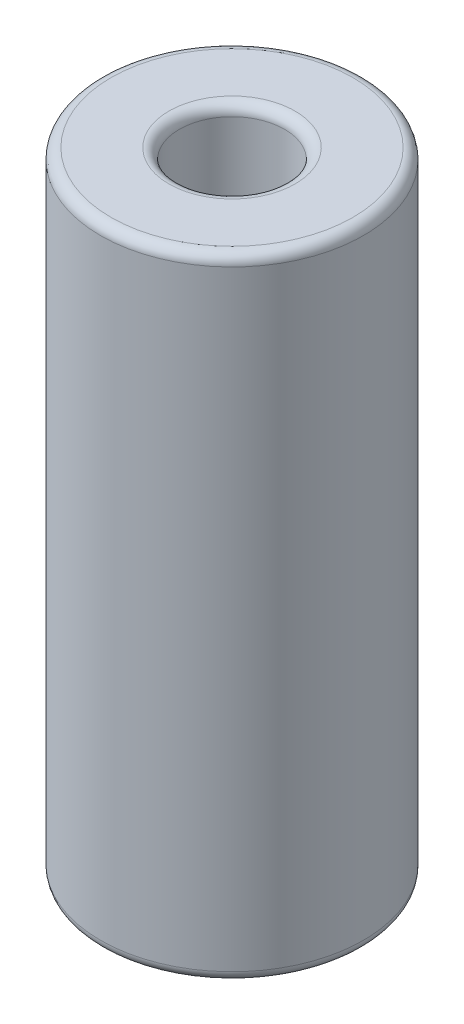
from build123d import *

# Parameters (mm, degrees)
SKETCH1_R           = 31.75
SKETCH1_R_2         = 12.7
BOSS_EXTRUDE1_DEPTH = 152.4
FILLET1_R           = 2.54


with BuildPart() as part:
    # Sketch1 → Boss-Extrude1 (new body)
    with BuildSketch(Plane(origin=(0, 0, 0), x_dir=(1, 0, 0), z_dir=(0, 1, 0))):
        with Locations(Location((0, 0, 0), (0, 0, 90))):
            Circle(SKETCH1_R)
        with Locations(Location((0, 0, 0), (0, 0, 90))):
            Circle(SKETCH1_R_2, mode=Mode.SUBTRACT)
    extrude(amount=BOSS_EXTRUDE1_DEPTH)

    # Fillet1
    fillet1_edges = [part.edges().sort_by_distance(p)[0] for p in [
        (0, 0, 31.75),
        (0, 152.4, 31.75),
        (0, 0, 12.7),
        (0, 152.4, 12.7),
    ]]
    fillet(fillet1_edges, radius=FILLET1_R)


solid = part.part
